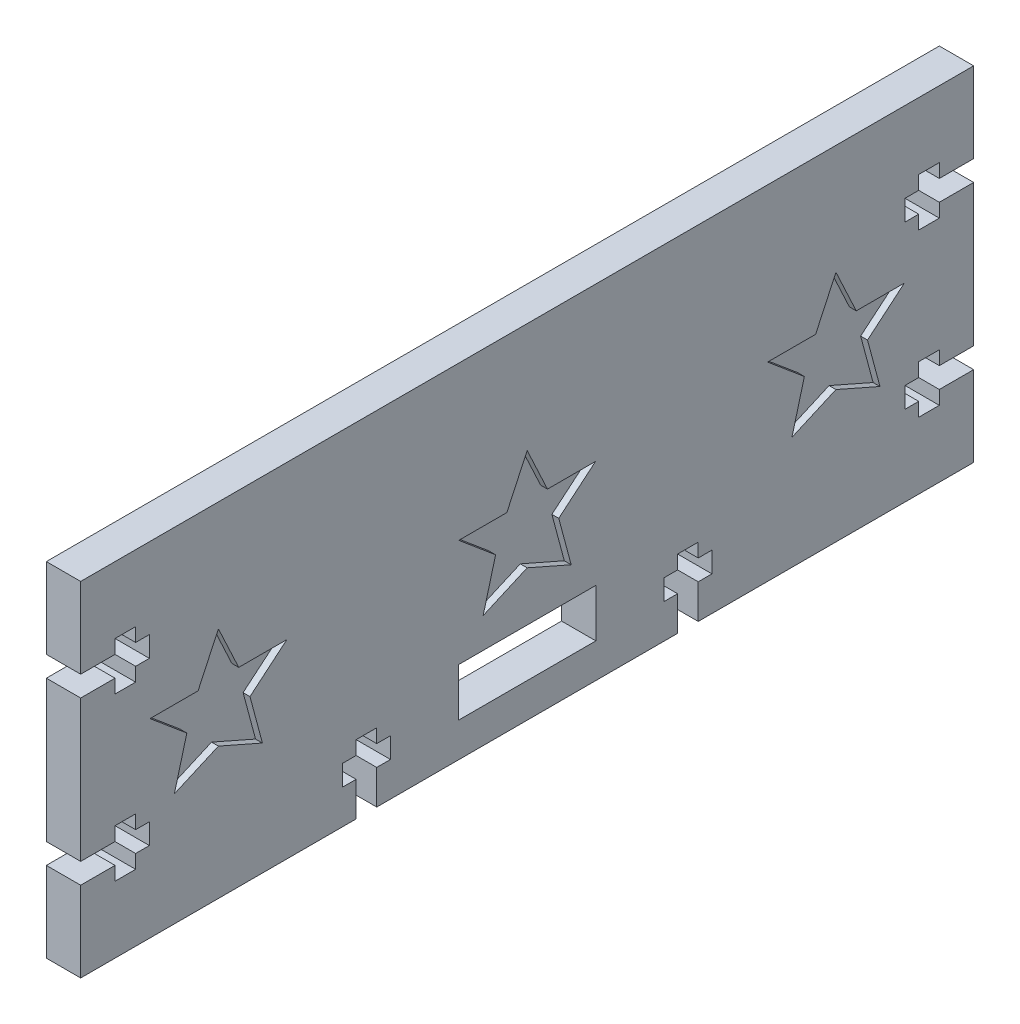
from build123d import *

# Parameters (mm, degrees)
BOSS_EXTRUDE1_DEPTH = 6.35
CUT_EXTRUDE1_DEPTH  = 178.004470283
CUT_EXTRUDE2_DEPTH  = 1.27
SKETCH4_W           = 25.4
SKETCH4_H           = 8.89
CUT_EXTRUDE3_DEPTH  = 178.004470283


with BuildPart() as part:
    # Sketch1 → Boss-Extrude1 (new body)
    with BuildSketch(Plane(origin=(0, 0, 0), x_dir=(0, 0, -1), z_dir=(1, 0, 0))):
        Polygon((0, 0), (165.1, 0), (165.1, -14.859), (158.75, -14.859), (158.75, -12.319), (154.94, -12.319), (154.94, -14.859), (152.4, -14.859), (152.4, -18.669), (154.94, -18.669), (154.94, -21.209), (158.75, -21.209), (158.75, -18.669), (165.1, -18.669), (165.1, -44.831), (158.75, -44.831), (158.75, -42.291), (154.94, -42.291), (154.94, -44.831), (152.4, -44.831), (152.4, -48.641), (154.94, -48.641), (154.94, -51.181), (158.75, -51.181), (158.75, -48.641), (165.1, -48.641), (165.1, -63.5), (0, -63.5), (0, -48.641), (6.35, -48.641), (6.35, -51.181), (10.16, -51.181), (10.16, -48.641), (12.7, -48.641), (12.7, -44.831), (10.16, -44.831), (10.16, -42.291), (6.35, -42.291), (6.35, -44.831), (0, -44.831), (0, -18.669), (6.35, -18.669), (6.35, -21.209), (10.16, -21.209), (10.16, -18.669), (12.7, -18.669), (12.7, -14.859), (10.16, -14.859), (10.16, -12.319), (6.35, -12.319), (6.35, -14.859), (0, -14.859), align=None)
    extrude(amount=BOSS_EXTRUDE1_DEPTH)

    # Sketch2 → Cut-Extrude1 (cut, through all)
    with BuildSketch(Plane(origin=(6.35, 0, 0), x_dir=(0, 0, -1), z_dir=(1, 0, 0))):
        Polygon((50.927, -63.5), (54.737, -63.5), (54.737, -57.15), (57.277, -57.15), (57.277, -53.34), (54.737, -53.34), (54.737, -50.8), (50.927, -50.8), (50.927, -53.34), (48.387, -53.34), (48.387, -57.15), (50.927, -57.15), align=None)
        Polygon((110.363, -63.5), (114.173, -63.5), (114.173, -57.15), (116.713, -57.15), (116.713, -53.34), (114.173, -53.34), (114.173, -50.8), (110.363, -50.8), (110.363, -53.34), (107.823, -53.34), (107.823, -57.15), (110.363, -57.15), align=None)
    extrude(amount=-CUT_EXTRUDE1_DEPTH, mode=Mode.SUBTRACT)

    # Sketch3 → Cut-Extrude2 (cut)
    with BuildSketch(Plane(origin=(6.35, 0, 0), x_dir=(0, 0, -1), z_dir=(1, 0, 0))):
        Polygon((82.55, -20.32), (78.792923653, -28.377076227), (69.902923653, -28.377076227), (76.713058752, -34.091458077), (74.412157441, -42.678538673), (82.55, -39.09976535), (90.687842559, -42.678538673), (88.386941248, -34.091458077), (95.197076347, -28.377076227), (86.307076347, -28.377076227), align=None)
        Polygon((25.4635, -20.32), (21.706423653, -28.377076227), (12.816423653, -28.377076227), (19.626558752, -34.091458077), (17.325657441, -42.678538673), (25.4635, -39.09976535), (33.601342559, -42.678538673), (31.300441248, -34.091458077), (38.110576347, -28.377076227), (29.220576347, -28.377076227), align=None)
        Polygon((139.6365, -20.32), (135.879423653, -28.377076227), (126.989423653, -28.377076227), (133.799558752, -34.091458077), (131.498657441, -42.678538673), (139.6365, -39.09976535), (147.774342559, -42.678538673), (145.473441248, -34.091458077), (152.283576347, -28.377076227), (143.393576347, -28.377076227), align=None)
    extrude(amount=-CUT_EXTRUDE2_DEPTH, mode=Mode.SUBTRACT)

    # Sketch4 → Cut-Extrude3 (cut, through all)
    with BuildSketch(Plane(origin=(6.35, 0, 0), x_dir=(0, 0, -1), z_dir=(1, 0, 0))):
        with Locations((82.55, -52.705)):
            Rectangle(SKETCH4_W, SKETCH4_H)
    extrude(amount=-CUT_EXTRUDE3_DEPTH, mode=Mode.SUBTRACT)


solid = part.part
